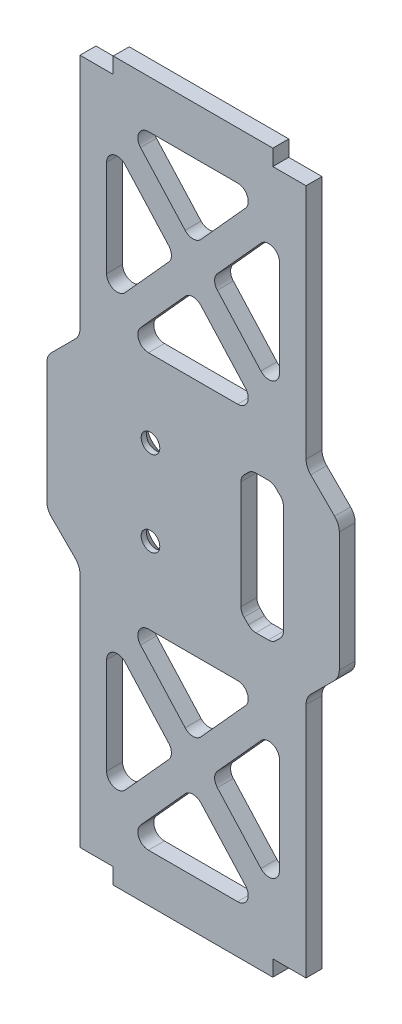
from build123d import *

# Parameters (mm, degrees)
SKETCH_1_W          = 55
SKETCH_1_H          = 129
SKETCH_1_W_2        = 30
SKETCH_1_H_2        = 6
EXTRUDE_1_DEPTH     = 3
SKETCH_2_R          = 1.75
CUT_EXTRUDE_1_DEPTH = 10
CUT_EXTRUDE_2_DEPTH = 10
FILLET_1_R          = 3
CHAMFER_1_SIZE      = 2
CUT_EXTRUDE_3_DEPTH = 10
FILLET_2_R          = 2


with BuildPart() as part:
    # Эскиз1 → Бобышка-Вытянуть1 (new body)
    with BuildSketch(Plane.XY):
        Rectangle(SKETCH_1_W, SKETCH_1_H)
        with Locations((0, 64.5)):
            Rectangle(SKETCH_1_W_2, SKETCH_1_H_2)
        with Locations((0, -64.5)):
            Rectangle(SKETCH_1_W_2, SKETCH_1_H_2)
    extrude(amount=EXTRUDE_1_DEPTH)

    # Эскиз2 → Вырез-Вытянуть1 (cut)
    with BuildSketch(Plane.XY.offset(3)):
        with Locations((-8, 8)):
            Circle(SKETCH_2_R)
        with Locations((-8, -8)):
            Circle(SKETCH_2_R)
    extrude(amount=-CUT_EXTRUDE_1_DEPTH, mode=Mode.SUBTRACT)

    # Эскиз3 → Вырез-Вытянуть2 (cut)
    with BuildSketch(Plane.XY.offset(3)):
        Polygon((-21.25, 64.5), (-21.25, 18.75), (-27.5, 12.5), (-35.562933311, 12.5), (-37.53189801, 71.38735117), align=None)
        Polygon((35.562933311, 12.5), (27.5, 12.5), (21.25, 18.75), (21.25, 64.5), (37.53189801, 71.38735117), align=None)
        Polygon((21.25, -64.5), (21.25, -18.75), (27.5, -12.5), (35.562933311, -12.5), (37.53189801, -71.38735117), align=None)
        Polygon((-35.562933311, -12.5), (-27.5, -12.5), (-21.25, -18.75), (-21.25, -64.5), (-37.53189801, -71.38735117), align=None)
    extrude(amount=-CUT_EXTRUDE_2_DEPTH, mode=Mode.SUBTRACT)

    # Скругление1
    fillet_1_edges = [part.edges().sort_by_distance(p)[0] for p in [
        (-21.25, 18.75, 1.5),
        (-27.5, 12.5, 1.5),
        (-27.5, -12.5, 1.5),
        (-21.25, -18.75, 1.5),
        (21.25, -18.75, 1.5),
        (27.5, -12.5, 1.5),
        (27.5, 12.5, 1.5),
        (21.25, 18.75, 1.5),
    ]]
    fillet(fillet_1_edges, radius=FILLET_1_R)

    # Фаска1
    chamfer_1_edges = [part.edges().sort_by_distance(p)[0] for p in [
        (-9.75, 8, 0),
        (-9.75, -8, 0),
    ]]
    chamfer(chamfer_1_edges, length=CHAMFER_1_SIZE)

    # Эскиз4 → Вырез-Вытянуть3 (cut)
    with BuildSketch(Plane.XY.offset(3)):
        Polygon((12.881944444, 22.5), (0, 36.769230769), (-12.881944444, 22.5), align=None)
        Polygon((-3.368055556, 40.5), (-16.25, 54.769230769), (-16.25, 26.230769231), align=None)
        Polygon((12.881944444, 58.5), (-12.881944444, 58.5), (0, 44.230769231), align=None)
        Polygon((16.25, 54.769230769), (3.368055556, 40.5), (16.25, 26.230769231), align=None)
        Polygon((15, -13), (11, -13), (9, -11), (9, 11), (11, 13), (15, 13), (17, 11), (17, -11), align=None)
        Polygon((-12.881944444, -22.5), (0, -36.769230769), (12.881944444, -22.5), align=None)
        Polygon((16.25, -26.230769231), (3.368055556, -40.5), (16.25, -54.769230769), align=None)
        Polygon((12.881944444, -58.5), (0, -44.230769231), (-12.881944444, -58.5), align=None)
        Polygon((-3.368055556, -40.5), (-16.25, -26.230769231), (-16.25, -54.769230769), align=None)
    extrude(amount=-CUT_EXTRUDE_3_DEPTH, mode=Mode.SUBTRACT)

    # Скругление2
    fillet_2_edges = [part.edges().sort_by_distance(p)[0] for p in [
        (16.25, -54.769230769, 1.5),
        (3.368055556, -40.5, 1.5),
        (16.25, -26.230769231, 1.5),
        (-12.881944444, -22.5, 1.5),
        (12.881944444, -22.5, 1.5),
        (0, -36.769230769, 1.5),
        (-16.25, -54.769230769, 1.5),
        (-16.25, -26.230769231, 1.5),
        (-3.368055556, -40.5, 1.5),
        (-12.881944444, -58.5, 1.5),
        (0, -44.230769231, 1.5),
        (12.881944444, -58.5, 1.5),
        (0, 44.230769231, 1.5),
        (-12.881944444, 58.5, 1.5),
        (12.881944444, 58.5, 1.5),
        (-16.25, 26.230769231, 1.5),
        (-16.25, 54.769230769, 1.5),
        (-3.368055556, 40.5, 1.5),
        (3.368055556, 40.5, 1.5),
        (16.25, 54.769230769, 1.5),
        (16.25, 26.230769231, 1.5),
        (15, -13, 1.5),
        (11, -13, 1.5),
        (9, -11, 1.5),
        (9, 11, 1.5),
        (11, 13, 1.5),
        (15, 13, 1.5),
        (17, 11, 1.5),
        (17, -11, 1.5),
        (-12.881944444, 22.5, 1.5),
        (0, 36.769230769, 1.5),
        (12.881944444, 22.5, 1.5),
    ]]
    fillet(fillet_2_edges, radius=FILLET_2_R)


solid = part.part
